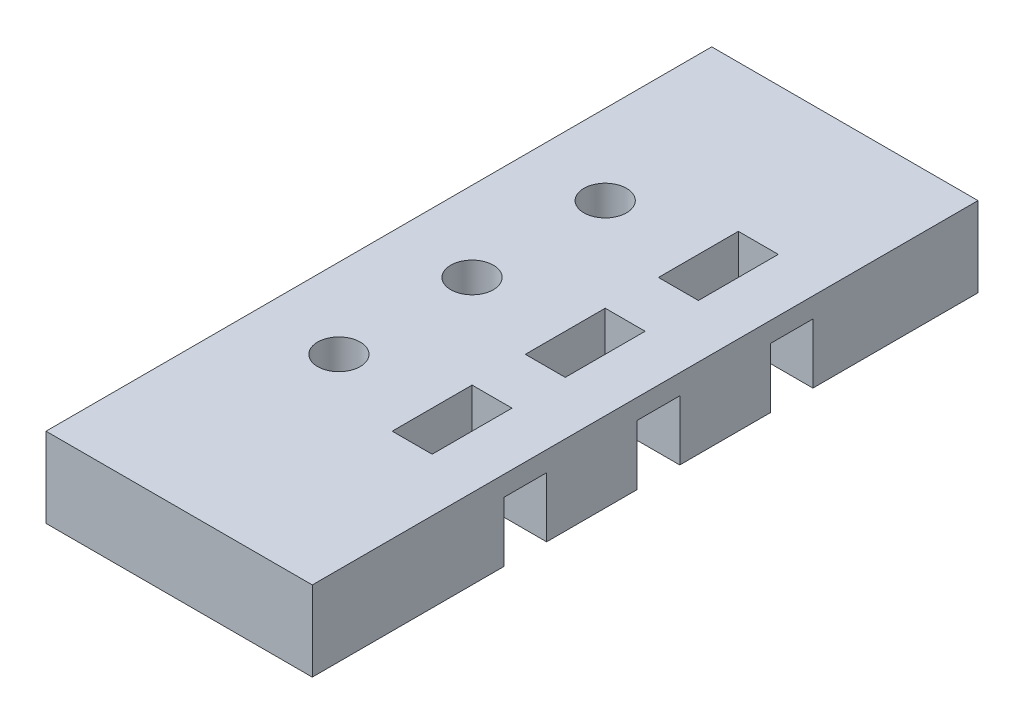
from build123d import *

# Parameters (mm, degrees)
SKETCH_1_W          = 20
SKETCH_1_H          = 50
EXTRUDE_1_DEPTH     = 6
SKETCH_3_W          = 4
SKETCH_3_H          = 3.2
CUT_EXTRUDE_1_DEPTH = 4.5
SKETCH_5_R          = 1.6
SKETCH_5_W          = 3
SKETCH_5_H          = 6
CUT_EXTRUDE_2_DEPTH = 14.5
SKETCH_7_R          = 3.5
CUT_EXTRUDE_3_DEPTH = 3


with BuildPart() as part:
    # 草图1 → 凸台-拉伸1 (new body)
    with BuildSketch(Plane(origin=(0, 0, 0), x_dir=(1, 0, 0), z_dir=(0, 1, 0))):
        with Locations((10, 25)):
            Rectangle(SKETCH_1_W, SKETCH_1_H)
    extrude(amount=EXTRUDE_1_DEPTH)

    # 草图3 → 切除-拉伸1 (cut)
    with BuildSketch(Plane.XZ):
        with Locations((18, -26)):
            Rectangle(SKETCH_3_W, SKETCH_3_H)
        with Locations((18, -16)):
            Rectangle(SKETCH_3_W, SKETCH_3_H)
        with Locations((18, -36)):
            Rectangle(SKETCH_3_W, SKETCH_3_H)
    extrude(amount=-CUT_EXTRUDE_1_DEPTH, mode=Mode.SUBTRACT)

    # 草图5 → 切除-拉伸2 (cut)
    with BuildSketch(Plane.XZ):
        with Locations(Location((6, -16, 0), (0, 0, 270))):
            Circle(SKETCH_5_R)
        with Locations(Location((6, -26, 0), (0, 0, 270))):
            Circle(SKETCH_5_R)
        with Locations(Location((6, -36, 0), (0, 0, 270))):
            Circle(SKETCH_5_R)
        with Locations((14.5, -36)):
            Rectangle(SKETCH_5_W, SKETCH_5_H)
        with Locations((14.5, -26)):
            Rectangle(SKETCH_5_W, SKETCH_5_H)
        with Locations((14.5, -16)):
            Rectangle(SKETCH_5_W, SKETCH_5_H)
    extrude(amount=-CUT_EXTRUDE_2_DEPTH, mode=Mode.SUBTRACT)

    # 草图7 → 切除-拉伸3 (cut)
    with BuildSketch(Plane.XZ):
        with Locations(Location((6, -16, 0), (0, 0, 270))):
            Circle(SKETCH_7_R)
        with Locations(Location((6, -26, 0), (0, 0, 270))):
            Circle(SKETCH_7_R)
        with Locations(Location((6, -36, 0), (0, 0, 270))):
            Circle(SKETCH_7_R)
    extrude(amount=-CUT_EXTRUDE_3_DEPTH, mode=Mode.SUBTRACT)


solid = part.part
